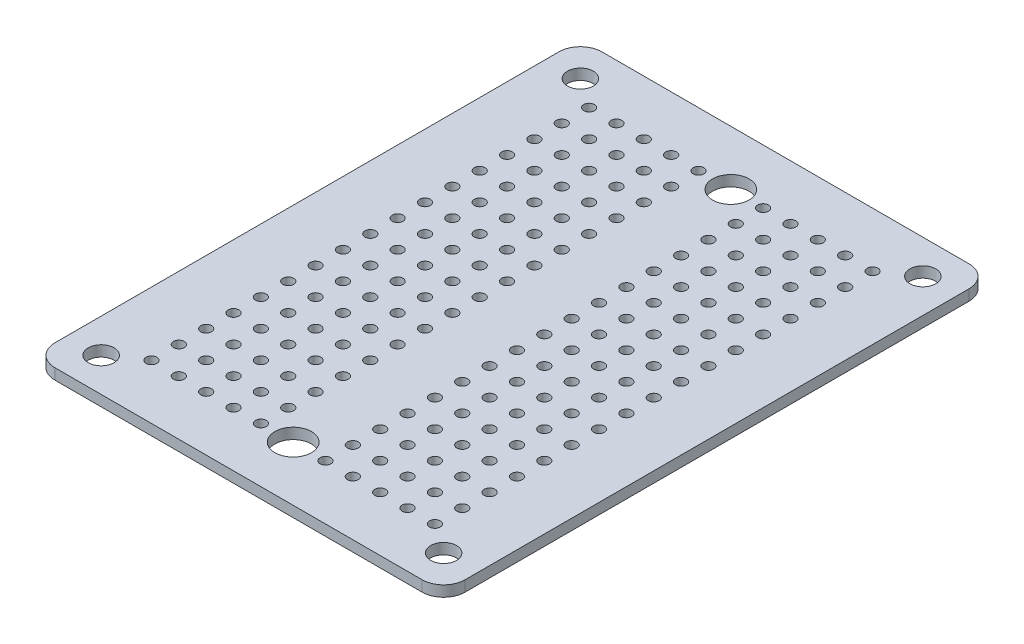
from build123d import *

# Parameters (mm, degrees)
SKETCH2_W                = 38.1
SKETCH2_H                = 50.8
BOSS_EXTRUDE1_DEPTH      = 0.5
M2_CLEARANCE_HOLE1_D     = 2.4
M3_CLEARANCE_HOLE1_D     = 3.4
FILLET2_R                = 2
SKETCH7_R                = 0.5
CUT_EXTRUDE1_DEPTH       = 32.765744128
LPATTERN1_COUNT          = 5
LPATTERN1_PITCH          = 2.54
LPATTERN1_COUNT_DIR2     = 17
LPATTERN1_PITCH_DIR2     = 2.54
MIRROR1_COPY_1_SKETCH_R  = 0.5
MIRROR1_COPY_1_DEPTH     = 32.765744128
MIRROR1_COPY_2_SKETCH_R  = 0.5
MIRROR1_COPY_2_DEPTH     = 32.765744128
MIRROR1_COPY_3_SKETCH_R  = 0.5
MIRROR1_COPY_3_DEPTH     = 32.765744128
MIRROR1_COPY_4_SKETCH_R  = 0.5
MIRROR1_COPY_4_DEPTH     = 32.765744128
MIRROR1_COPY_5_SKETCH_R  = 0.5
MIRROR1_COPY_5_DEPTH     = 32.765744128
MIRROR1_COPY_6_SKETCH_R  = 0.5
MIRROR1_COPY_6_DEPTH     = 32.765744128
MIRROR1_COPY_7_SKETCH_R  = 0.5
MIRROR1_COPY_7_DEPTH     = 32.765744128
MIRROR1_COPY_8_SKETCH_R  = 0.5
MIRROR1_COPY_8_DEPTH     = 32.765744128
MIRROR1_COPY_9_SKETCH_R  = 0.5
MIRROR1_COPY_9_DEPTH     = 32.765744128
MIRROR1_COPY_10_SKETCH_R = 0.5
MIRROR1_COPY_10_DEPTH    = 32.765744128
MIRROR1_COPY_11_SKETCH_R = 0.5
MIRROR1_COPY_11_DEPTH    = 32.765744128
MIRROR1_COPY_12_SKETCH_R = 0.5
MIRROR1_COPY_12_DEPTH    = 32.765744128
MIRROR1_COPY_13_SKETCH_R = 0.5
MIRROR1_COPY_13_DEPTH    = 32.765744128
MIRROR1_COPY_14_SKETCH_R = 0.5
MIRROR1_COPY_14_DEPTH    = 32.765744128
MIRROR1_COPY_15_SKETCH_R = 0.5
MIRROR1_COPY_15_DEPTH    = 32.765744128
MIRROR1_COPY_16_SKETCH_R = 0.5
MIRROR1_COPY_16_DEPTH    = 32.765744128
MIRROR1_COPY_17_SKETCH_R = 0.5
MIRROR1_COPY_17_DEPTH    = 32.765744128
MIRROR1_COPY_18_SKETCH_R = 0.5
MIRROR1_COPY_18_DEPTH    = 32.765744128
MIRROR1_COPY_19_SKETCH_R = 0.5
MIRROR1_COPY_19_DEPTH    = 32.765744128
MIRROR1_COPY_20_SKETCH_R = 0.5
MIRROR1_COPY_20_DEPTH    = 32.765744128
MIRROR1_COPY_21_SKETCH_R = 0.5
MIRROR1_COPY_21_DEPTH    = 32.765744128
MIRROR1_COPY_22_SKETCH_R = 0.5
MIRROR1_COPY_22_DEPTH    = 32.765744128
MIRROR1_COPY_23_SKETCH_R = 0.5
MIRROR1_COPY_23_DEPTH    = 32.765744128
MIRROR1_COPY_24_SKETCH_R = 0.5
MIRROR1_COPY_24_DEPTH    = 32.765744128
MIRROR1_COPY_25_SKETCH_R = 0.5
MIRROR1_COPY_25_DEPTH    = 32.765744128
MIRROR1_COPY_26_SKETCH_R = 0.5
MIRROR1_COPY_26_DEPTH    = 32.765744128
MIRROR1_COPY_27_SKETCH_R = 0.5
MIRROR1_COPY_27_DEPTH    = 32.765744128
MIRROR1_COPY_28_SKETCH_R = 0.5
MIRROR1_COPY_28_DEPTH    = 32.765744128
MIRROR1_COPY_29_SKETCH_R = 0.5
MIRROR1_COPY_29_DEPTH    = 32.765744128
MIRROR1_COPY_30_SKETCH_R = 0.5
MIRROR1_COPY_30_DEPTH    = 32.765744128
MIRROR1_COPY_31_SKETCH_R = 0.5
MIRROR1_COPY_31_DEPTH    = 32.765744128
MIRROR1_COPY_32_SKETCH_R = 0.5
MIRROR1_COPY_32_DEPTH    = 32.765744128
MIRROR1_COPY_33_SKETCH_R = 0.5
MIRROR1_COPY_33_DEPTH    = 32.765744128
MIRROR1_COPY_34_SKETCH_R = 0.5
MIRROR1_COPY_34_DEPTH    = 32.765744128
MIRROR1_COPY_35_SKETCH_R = 0.5
MIRROR1_COPY_35_DEPTH    = 32.765744128
MIRROR1_COPY_36_SKETCH_R = 0.5
MIRROR1_COPY_36_DEPTH    = 32.765744128
MIRROR1_COPY_37_SKETCH_R = 0.5
MIRROR1_COPY_37_DEPTH    = 32.765744128
MIRROR1_COPY_38_SKETCH_R = 0.5
MIRROR1_COPY_38_DEPTH    = 32.765744128
MIRROR1_COPY_39_SKETCH_R = 0.5
MIRROR1_COPY_39_DEPTH    = 32.765744128
MIRROR1_COPY_40_SKETCH_R = 0.5
MIRROR1_COPY_40_DEPTH    = 32.765744128
MIRROR1_COPY_41_SKETCH_R = 0.5
MIRROR1_COPY_41_DEPTH    = 32.765744128
MIRROR1_COPY_42_SKETCH_R = 0.5
MIRROR1_COPY_42_DEPTH    = 32.765744128
MIRROR1_COPY_43_SKETCH_R = 0.5
MIRROR1_COPY_43_DEPTH    = 32.765744128
MIRROR1_COPY_44_SKETCH_R = 0.5
MIRROR1_COPY_44_DEPTH    = 32.765744128
MIRROR1_COPY_45_SKETCH_R = 0.5
MIRROR1_COPY_45_DEPTH    = 32.765744128
MIRROR1_COPY_46_SKETCH_R = 0.5
MIRROR1_COPY_46_DEPTH    = 32.765744128
MIRROR1_COPY_47_SKETCH_R = 0.5
MIRROR1_COPY_47_DEPTH    = 32.765744128
MIRROR1_COPY_48_SKETCH_R = 0.5
MIRROR1_COPY_48_DEPTH    = 32.765744128
MIRROR1_COPY_49_SKETCH_R = 0.5
MIRROR1_COPY_49_DEPTH    = 32.765744128
MIRROR1_COPY_50_SKETCH_R = 0.5
MIRROR1_COPY_50_DEPTH    = 32.765744128
MIRROR1_COPY_51_SKETCH_R = 0.5
MIRROR1_COPY_51_DEPTH    = 32.765744128
MIRROR1_COPY_52_SKETCH_R = 0.5
MIRROR1_COPY_52_DEPTH    = 32.765744128
MIRROR1_COPY_53_SKETCH_R = 0.5
MIRROR1_COPY_53_DEPTH    = 32.765744128
MIRROR1_COPY_54_SKETCH_R = 0.5
MIRROR1_COPY_54_DEPTH    = 32.765744128
MIRROR1_COPY_55_SKETCH_R = 0.5
MIRROR1_COPY_55_DEPTH    = 32.765744128
MIRROR1_COPY_56_SKETCH_R = 0.5
MIRROR1_COPY_56_DEPTH    = 32.765744128
MIRROR1_COPY_57_SKETCH_R = 0.5
MIRROR1_COPY_57_DEPTH    = 32.765744128
MIRROR1_COPY_58_SKETCH_R = 0.5
MIRROR1_COPY_58_DEPTH    = 32.765744128
MIRROR1_COPY_59_SKETCH_R = 0.5
MIRROR1_COPY_59_DEPTH    = 32.765744128
MIRROR1_COPY_60_SKETCH_R = 0.5
MIRROR1_COPY_60_DEPTH    = 32.765744128
MIRROR1_COPY_61_SKETCH_R = 0.5
MIRROR1_COPY_61_DEPTH    = 32.765744128
MIRROR1_COPY_62_SKETCH_R = 0.5
MIRROR1_COPY_62_DEPTH    = 32.765744128
MIRROR1_COPY_63_SKETCH_R = 0.5
MIRROR1_COPY_63_DEPTH    = 32.765744128
MIRROR1_COPY_64_SKETCH_R = 0.5
MIRROR1_COPY_64_DEPTH    = 32.765744128
MIRROR1_COPY_65_SKETCH_R = 0.5
MIRROR1_COPY_65_DEPTH    = 32.765744128
MIRROR1_COPY_66_SKETCH_R = 0.5
MIRROR1_COPY_66_DEPTH    = 32.765744128
MIRROR1_COPY_67_SKETCH_R = 0.5
MIRROR1_COPY_67_DEPTH    = 32.765744128
MIRROR1_COPY_68_SKETCH_R = 0.5
MIRROR1_COPY_68_DEPTH    = 32.765744128
MIRROR1_COPY_69_SKETCH_R = 0.5
MIRROR1_COPY_69_DEPTH    = 32.765744128
MIRROR1_COPY_70_SKETCH_R = 0.5
MIRROR1_COPY_70_DEPTH    = 32.765744128
MIRROR1_COPY_71_SKETCH_R = 0.5
MIRROR1_COPY_71_DEPTH    = 32.765744128
MIRROR1_COPY_72_SKETCH_R = 0.5
MIRROR1_COPY_72_DEPTH    = 32.765744128
MIRROR1_COPY_73_SKETCH_R = 0.5
MIRROR1_COPY_73_DEPTH    = 32.765744128
MIRROR1_COPY_74_SKETCH_R = 0.5
MIRROR1_COPY_74_DEPTH    = 32.765744128
MIRROR1_COPY_75_SKETCH_R = 0.5
MIRROR1_COPY_75_DEPTH    = 32.765744128
MIRROR1_COPY_76_SKETCH_R = 0.5
MIRROR1_COPY_76_DEPTH    = 32.765744128
MIRROR1_COPY_77_SKETCH_R = 0.5
MIRROR1_COPY_77_DEPTH    = 32.765744128
MIRROR1_COPY_78_SKETCH_R = 0.5
MIRROR1_COPY_78_DEPTH    = 32.765744128
MIRROR1_COPY_79_SKETCH_R = 0.5
MIRROR1_COPY_79_DEPTH    = 32.765744128
MIRROR1_COPY_80_SKETCH_R = 0.5
MIRROR1_COPY_80_DEPTH    = 32.765744128
MIRROR1_COPY_81_SKETCH_R = 0.5
MIRROR1_COPY_81_DEPTH    = 32.765744128
MIRROR1_COPY_82_SKETCH_R = 0.5
MIRROR1_COPY_82_DEPTH    = 32.765744128
MIRROR1_COPY_83_SKETCH_R = 0.5
MIRROR1_COPY_83_DEPTH    = 32.765744128
MIRROR1_COPY_84_SKETCH_R = 0.5
MIRROR1_COPY_84_DEPTH    = 32.765744128


with BuildPart() as part:
    # Sketch2 → Boss-Extrude1 (new, symmetric)
    with BuildSketch(Plane(origin=(0, 0, 0), x_dir=(1, 0, 0), z_dir=(0, 1, 0))):
        Rectangle(SKETCH2_W, SKETCH2_H)
    extrude(amount=BOSS_EXTRUDE1_DEPTH, both=True)

    # M2 Clearance Hole1 (through all)
    with Locations(Plane(origin=(0, 0.5, 0), x_dir=(1, 0, 0), z_dir=(0, 1, 0))):
        with Locations((15.9, 22.25), (-15.9, -22.25), (-15.9, 22.25), (15.9, -22.25)):
            Hole(M2_CLEARANCE_HOLE1_D / 2)

    # M3 Clearance Hole1 (through all)
    with Locations(Plane(origin=(0, 0.5, 0), x_dir=(1, 0, 0), z_dir=(0, 1, 0))):
        with Locations((0, 20.32), (0, -20.32)):
            Hole(M3_CLEARANCE_HOLE1_D / 2)

    # Fillet2
    fillet2_edges = [part.edges().sort_by_distance(p)[0] for p in [
        (19.05, 0, 25.4),
        (-19.05, 0, 25.4),
        (-19.05, 0, -25.4),
        (19.05, 0, -25.4),
    ]]
    fillet(fillet2_edges, radius=FILLET2_R)

    # Sketch7 → Cut-Extrude1 (cut, symmetric)
    with BuildSketch(Plane(origin=(0, 0.5, 0), x_dir=(1, 0, 0), z_dir=(0, 1, 0))):
        with Locations(Location((-3, 20.32, 0), (0, 0, 270))):
            Circle(SKETCH7_R)
    cut_extrude1 = extrude(amount=CUT_EXTRUDE1_DEPTH, both=True, mode=Mode.SUBTRACT)

    # LPattern1: Cut-Extrude1 5 × 17
    with Locations(*[(-i * LPATTERN1_PITCH, 0, j * LPATTERN1_PITCH_DIR2) for i in range(LPATTERN1_COUNT) for j in range(LPATTERN1_COUNT_DIR2) if (i, j) != (0, 0)]):
        add(cut_extrude1, mode=Mode.SUBTRACT)

    # Mirror1: Cut-Extrude1 across plane
    add(cut_extrude1.mirror(Plane(origin=(0, 0, 0), x_dir=(0, 0, 1), z_dir=(1, 0, 0))), mode=Mode.SUBTRACT)

    # Mirror1 copy 1 sketch → Mirror1 copy 1 (cut, symmetric)
    with BuildSketch(Plane(origin=(0, 0.5, 2.54), x_dir=(-1, 0, 0), z_dir=(0, 1, 0))):
        with Locations((-3, -20.32)):
            Circle(MIRROR1_COPY_1_SKETCH_R)
    extrude(amount=MIRROR1_COPY_1_DEPTH, both=True, mode=Mode.SUBTRACT)

    # Mirror1 copy 2 sketch → Mirror1 copy 2 (cut, symmetric)
    with BuildSketch(Plane(origin=(0, 0.5, 5.08), x_dir=(-1, 0, 0), z_dir=(0, 1, 0))):
        with Locations((-3, -20.32)):
            Circle(MIRROR1_COPY_2_SKETCH_R)
    extrude(amount=MIRROR1_COPY_2_DEPTH, both=True, mode=Mode.SUBTRACT)

    # Mirror1 copy 3 sketch → Mirror1 copy 3 (cut, symmetric)
    with BuildSketch(Plane(origin=(0, 0.5, 7.62), x_dir=(-1, 0, 0), z_dir=(0, 1, 0))):
        with Locations((-3, -20.32)):
            Circle(MIRROR1_COPY_3_SKETCH_R)
    extrude(amount=MIRROR1_COPY_3_DEPTH, both=True, mode=Mode.SUBTRACT)

    # Mirror1 copy 4 sketch → Mirror1 copy 4 (cut, symmetric)
    with BuildSketch(Plane(origin=(0, 0.5, 10.16), x_dir=(-1, 0, 0), z_dir=(0, 1, 0))):
        with Locations((-3, -20.32)):
            Circle(MIRROR1_COPY_4_SKETCH_R)
    extrude(amount=MIRROR1_COPY_4_DEPTH, both=True, mode=Mode.SUBTRACT)

    # Mirror1 copy 5 sketch → Mirror1 copy 5 (cut, symmetric)
    with BuildSketch(Plane(origin=(0, 0.5, 12.7), x_dir=(-1, 0, 0), z_dir=(0, 1, 0))):
        with Locations((-3, -20.32)):
            Circle(MIRROR1_COPY_5_SKETCH_R)
    extrude(amount=MIRROR1_COPY_5_DEPTH, both=True, mode=Mode.SUBTRACT)

    # Mirror1 copy 6 sketch → Mirror1 copy 6 (cut, symmetric)
    with BuildSketch(Plane(origin=(0, 0.5, 15.24), x_dir=(-1, 0, 0), z_dir=(0, 1, 0))):
        with Locations((-3, -20.32)):
            Circle(MIRROR1_COPY_6_SKETCH_R)
    extrude(amount=MIRROR1_COPY_6_DEPTH, both=True, mode=Mode.SUBTRACT)

    # Mirror1 copy 7 sketch → Mirror1 copy 7 (cut, symmetric)
    with BuildSketch(Plane(origin=(0, 0.5, 17.78), x_dir=(-1, 0, 0), z_dir=(0, 1, 0))):
        with Locations((-3, -20.32)):
            Circle(MIRROR1_COPY_7_SKETCH_R)
    extrude(amount=MIRROR1_COPY_7_DEPTH, both=True, mode=Mode.SUBTRACT)

    # Mirror1 copy 8 sketch → Mirror1 copy 8 (cut, symmetric)
    with BuildSketch(Plane(origin=(0, 0.5, 20.32), x_dir=(-1, 0, 0), z_dir=(0, 1, 0))):
        with Locations((-3, -20.32)):
            Circle(MIRROR1_COPY_8_SKETCH_R)
    extrude(amount=MIRROR1_COPY_8_DEPTH, both=True, mode=Mode.SUBTRACT)

    # Mirror1 copy 9 sketch → Mirror1 copy 9 (cut, symmetric)
    with BuildSketch(Plane(origin=(0, 0.5, 22.86), x_dir=(-1, 0, 0), z_dir=(0, 1, 0))):
        with Locations((-3, -20.32)):
            Circle(MIRROR1_COPY_9_SKETCH_R)
    extrude(amount=MIRROR1_COPY_9_DEPTH, both=True, mode=Mode.SUBTRACT)

    # Mirror1 copy 10 sketch → Mirror1 copy 10 (cut, symmetric)
    with BuildSketch(Plane(origin=(0, 0.5, 25.4), x_dir=(-1, 0, 0), z_dir=(0, 1, 0))):
        with Locations((-3, -20.32)):
            Circle(MIRROR1_COPY_10_SKETCH_R)
    extrude(amount=MIRROR1_COPY_10_DEPTH, both=True, mode=Mode.SUBTRACT)

    # Mirror1 copy 11 sketch → Mirror1 copy 11 (cut, symmetric)
    with BuildSketch(Plane(origin=(0, 0.5, 27.94), x_dir=(-1, 0, 0), z_dir=(0, 1, 0))):
        with Locations((-3, -20.32)):
            Circle(MIRROR1_COPY_11_SKETCH_R)
    extrude(amount=MIRROR1_COPY_11_DEPTH, both=True, mode=Mode.SUBTRACT)

    # Mirror1 copy 12 sketch → Mirror1 copy 12 (cut, symmetric)
    with BuildSketch(Plane(origin=(0, 0.5, 30.48), x_dir=(-1, 0, 0), z_dir=(0, 1, 0))):
        with Locations((-3, -20.32)):
            Circle(MIRROR1_COPY_12_SKETCH_R)
    extrude(amount=MIRROR1_COPY_12_DEPTH, both=True, mode=Mode.SUBTRACT)

    # Mirror1 copy 13 sketch → Mirror1 copy 13 (cut, symmetric)
    with BuildSketch(Plane(origin=(0, 0.5, 33.02), x_dir=(-1, 0, 0), z_dir=(0, 1, 0))):
        with Locations((-3, -20.32)):
            Circle(MIRROR1_COPY_13_SKETCH_R)
    extrude(amount=MIRROR1_COPY_13_DEPTH, both=True, mode=Mode.SUBTRACT)

    # Mirror1 copy 14 sketch → Mirror1 copy 14 (cut, symmetric)
    with BuildSketch(Plane(origin=(0, 0.5, 35.56), x_dir=(-1, 0, 0), z_dir=(0, 1, 0))):
        with Locations((-3, -20.32)):
            Circle(MIRROR1_COPY_14_SKETCH_R)
    extrude(amount=MIRROR1_COPY_14_DEPTH, both=True, mode=Mode.SUBTRACT)

    # Mirror1 copy 15 sketch → Mirror1 copy 15 (cut, symmetric)
    with BuildSketch(Plane(origin=(0, 0.5, 38.1), x_dir=(-1, 0, 0), z_dir=(0, 1, 0))):
        with Locations((-3, -20.32)):
            Circle(MIRROR1_COPY_15_SKETCH_R)
    extrude(amount=MIRROR1_COPY_15_DEPTH, both=True, mode=Mode.SUBTRACT)

    # Mirror1 copy 16 sketch → Mirror1 copy 16 (cut, symmetric)
    with BuildSketch(Plane(origin=(0, 0.5, 40.64), x_dir=(-1, 0, 0), z_dir=(0, 1, 0))):
        with Locations((-3, -20.32)):
            Circle(MIRROR1_COPY_16_SKETCH_R)
    extrude(amount=MIRROR1_COPY_16_DEPTH, both=True, mode=Mode.SUBTRACT)

    # Mirror1 copy 17 sketch → Mirror1 copy 17 (cut, symmetric)
    with BuildSketch(Plane(origin=(2.54, 0.5, 0), x_dir=(-1, 0, 0), z_dir=(0, 1, 0))):
        with Locations((-3, -20.32)):
            Circle(MIRROR1_COPY_17_SKETCH_R)
    extrude(amount=MIRROR1_COPY_17_DEPTH, both=True, mode=Mode.SUBTRACT)

    # Mirror1 copy 18 sketch → Mirror1 copy 18 (cut, symmetric)
    with BuildSketch(Plane(origin=(2.54, 0.5, 2.54), x_dir=(-1, 0, 0), z_dir=(0, 1, 0))):
        with Locations((-3, -20.32)):
            Circle(MIRROR1_COPY_18_SKETCH_R)
    extrude(amount=MIRROR1_COPY_18_DEPTH, both=True, mode=Mode.SUBTRACT)

    # Mirror1 copy 19 sketch → Mirror1 copy 19 (cut, symmetric)
    with BuildSketch(Plane(origin=(2.54, 0.5, 5.08), x_dir=(-1, 0, 0), z_dir=(0, 1, 0))):
        with Locations((-3, -20.32)):
            Circle(MIRROR1_COPY_19_SKETCH_R)
    extrude(amount=MIRROR1_COPY_19_DEPTH, both=True, mode=Mode.SUBTRACT)

    # Mirror1 copy 20 sketch → Mirror1 copy 20 (cut, symmetric)
    with BuildSketch(Plane(origin=(2.54, 0.5, 7.62), x_dir=(-1, 0, 0), z_dir=(0, 1, 0))):
        with Locations((-3, -20.32)):
            Circle(MIRROR1_COPY_20_SKETCH_R)
    extrude(amount=MIRROR1_COPY_20_DEPTH, both=True, mode=Mode.SUBTRACT)

    # Mirror1 copy 21 sketch → Mirror1 copy 21 (cut, symmetric)
    with BuildSketch(Plane(origin=(2.54, 0.5, 10.16), x_dir=(-1, 0, 0), z_dir=(0, 1, 0))):
        with Locations((-3, -20.32)):
            Circle(MIRROR1_COPY_21_SKETCH_R)
    extrude(amount=MIRROR1_COPY_21_DEPTH, both=True, mode=Mode.SUBTRACT)

    # Mirror1 copy 22 sketch → Mirror1 copy 22 (cut, symmetric)
    with BuildSketch(Plane(origin=(2.54, 0.5, 12.7), x_dir=(-1, 0, 0), z_dir=(0, 1, 0))):
        with Locations((-3, -20.32)):
            Circle(MIRROR1_COPY_22_SKETCH_R)
    extrude(amount=MIRROR1_COPY_22_DEPTH, both=True, mode=Mode.SUBTRACT)

    # Mirror1 copy 23 sketch → Mirror1 copy 23 (cut, symmetric)
    with BuildSketch(Plane(origin=(2.54, 0.5, 15.24), x_dir=(-1, 0, 0), z_dir=(0, 1, 0))):
        with Locations((-3, -20.32)):
            Circle(MIRROR1_COPY_23_SKETCH_R)
    extrude(amount=MIRROR1_COPY_23_DEPTH, both=True, mode=Mode.SUBTRACT)

    # Mirror1 copy 24 sketch → Mirror1 copy 24 (cut, symmetric)
    with BuildSketch(Plane(origin=(2.54, 0.5, 17.78), x_dir=(-1, 0, 0), z_dir=(0, 1, 0))):
        with Locations((-3, -20.32)):
            Circle(MIRROR1_COPY_24_SKETCH_R)
    extrude(amount=MIRROR1_COPY_24_DEPTH, both=True, mode=Mode.SUBTRACT)

    # Mirror1 copy 25 sketch → Mirror1 copy 25 (cut, symmetric)
    with BuildSketch(Plane(origin=(2.54, 0.5, 20.32), x_dir=(-1, 0, 0), z_dir=(0, 1, 0))):
        with Locations((-3, -20.32)):
            Circle(MIRROR1_COPY_25_SKETCH_R)
    extrude(amount=MIRROR1_COPY_25_DEPTH, both=True, mode=Mode.SUBTRACT)

    # Mirror1 copy 26 sketch → Mirror1 copy 26 (cut, symmetric)
    with BuildSketch(Plane(origin=(2.54, 0.5, 22.86), x_dir=(-1, 0, 0), z_dir=(0, 1, 0))):
        with Locations((-3, -20.32)):
            Circle(MIRROR1_COPY_26_SKETCH_R)
    extrude(amount=MIRROR1_COPY_26_DEPTH, both=True, mode=Mode.SUBTRACT)

    # Mirror1 copy 27 sketch → Mirror1 copy 27 (cut, symmetric)
    with BuildSketch(Plane(origin=(2.54, 0.5, 25.4), x_dir=(-1, 0, 0), z_dir=(0, 1, 0))):
        with Locations((-3, -20.32)):
            Circle(MIRROR1_COPY_27_SKETCH_R)
    extrude(amount=MIRROR1_COPY_27_DEPTH, both=True, mode=Mode.SUBTRACT)

    # Mirror1 copy 28 sketch → Mirror1 copy 28 (cut, symmetric)
    with BuildSketch(Plane(origin=(2.54, 0.5, 27.94), x_dir=(-1, 0, 0), z_dir=(0, 1, 0))):
        with Locations((-3, -20.32)):
            Circle(MIRROR1_COPY_28_SKETCH_R)
    extrude(amount=MIRROR1_COPY_28_DEPTH, both=True, mode=Mode.SUBTRACT)

    # Mirror1 copy 29 sketch → Mirror1 copy 29 (cut, symmetric)
    with BuildSketch(Plane(origin=(2.54, 0.5, 30.48), x_dir=(-1, 0, 0), z_dir=(0, 1, 0))):
        with Locations((-3, -20.32)):
            Circle(MIRROR1_COPY_29_SKETCH_R)
    extrude(amount=MIRROR1_COPY_29_DEPTH, both=True, mode=Mode.SUBTRACT)

    # Mirror1 copy 30 sketch → Mirror1 copy 30 (cut, symmetric)
    with BuildSketch(Plane(origin=(2.54, 0.5, 33.02), x_dir=(-1, 0, 0), z_dir=(0, 1, 0))):
        with Locations((-3, -20.32)):
            Circle(MIRROR1_COPY_30_SKETCH_R)
    extrude(amount=MIRROR1_COPY_30_DEPTH, both=True, mode=Mode.SUBTRACT)

    # Mirror1 copy 31 sketch → Mirror1 copy 31 (cut, symmetric)
    with BuildSketch(Plane(origin=(2.54, 0.5, 35.56), x_dir=(-1, 0, 0), z_dir=(0, 1, 0))):
        with Locations((-3, -20.32)):
            Circle(MIRROR1_COPY_31_SKETCH_R)
    extrude(amount=MIRROR1_COPY_31_DEPTH, both=True, mode=Mode.SUBTRACT)

    # Mirror1 copy 32 sketch → Mirror1 copy 32 (cut, symmetric)
    with BuildSketch(Plane(origin=(2.54, 0.5, 38.1), x_dir=(-1, 0, 0), z_dir=(0, 1, 0))):
        with Locations((-3, -20.32)):
            Circle(MIRROR1_COPY_32_SKETCH_R)
    extrude(amount=MIRROR1_COPY_32_DEPTH, both=True, mode=Mode.SUBTRACT)

    # Mirror1 copy 33 sketch → Mirror1 copy 33 (cut, symmetric)
    with BuildSketch(Plane(origin=(2.54, 0.5, 40.64), x_dir=(-1, 0, 0), z_dir=(0, 1, 0))):
        with Locations((-3, -20.32)):
            Circle(MIRROR1_COPY_33_SKETCH_R)
    extrude(amount=MIRROR1_COPY_33_DEPTH, both=True, mode=Mode.SUBTRACT)

    # Mirror1 copy 34 sketch → Mirror1 copy 34 (cut, symmetric)
    with BuildSketch(Plane(origin=(5.08, 0.5, 0), x_dir=(-1, 0, 0), z_dir=(0, 1, 0))):
        with Locations((-3, -20.32)):
            Circle(MIRROR1_COPY_34_SKETCH_R)
    extrude(amount=MIRROR1_COPY_34_DEPTH, both=True, mode=Mode.SUBTRACT)

    # Mirror1 copy 35 sketch → Mirror1 copy 35 (cut, symmetric)
    with BuildSketch(Plane(origin=(5.08, 0.5, 2.54), x_dir=(-1, 0, 0), z_dir=(0, 1, 0))):
        with Locations((-3, -20.32)):
            Circle(MIRROR1_COPY_35_SKETCH_R)
    extrude(amount=MIRROR1_COPY_35_DEPTH, both=True, mode=Mode.SUBTRACT)

    # Mirror1 copy 36 sketch → Mirror1 copy 36 (cut, symmetric)
    with BuildSketch(Plane(origin=(5.08, 0.5, 5.08), x_dir=(-1, 0, 0), z_dir=(0, 1, 0))):
        with Locations((-3, -20.32)):
            Circle(MIRROR1_COPY_36_SKETCH_R)
    extrude(amount=MIRROR1_COPY_36_DEPTH, both=True, mode=Mode.SUBTRACT)

    # Mirror1 copy 37 sketch → Mirror1 copy 37 (cut, symmetric)
    with BuildSketch(Plane(origin=(5.08, 0.5, 7.62), x_dir=(-1, 0, 0), z_dir=(0, 1, 0))):
        with Locations((-3, -20.32)):
            Circle(MIRROR1_COPY_37_SKETCH_R)
    extrude(amount=MIRROR1_COPY_37_DEPTH, both=True, mode=Mode.SUBTRACT)

    # Mirror1 copy 38 sketch → Mirror1 copy 38 (cut, symmetric)
    with BuildSketch(Plane(origin=(5.08, 0.5, 10.16), x_dir=(-1, 0, 0), z_dir=(0, 1, 0))):
        with Locations((-3, -20.32)):
            Circle(MIRROR1_COPY_38_SKETCH_R)
    extrude(amount=MIRROR1_COPY_38_DEPTH, both=True, mode=Mode.SUBTRACT)

    # Mirror1 copy 39 sketch → Mirror1 copy 39 (cut, symmetric)
    with BuildSketch(Plane(origin=(5.08, 0.5, 12.7), x_dir=(-1, 0, 0), z_dir=(0, 1, 0))):
        with Locations((-3, -20.32)):
            Circle(MIRROR1_COPY_39_SKETCH_R)
    extrude(amount=MIRROR1_COPY_39_DEPTH, both=True, mode=Mode.SUBTRACT)

    # Mirror1 copy 40 sketch → Mirror1 copy 40 (cut, symmetric)
    with BuildSketch(Plane(origin=(5.08, 0.5, 15.24), x_dir=(-1, 0, 0), z_dir=(0, 1, 0))):
        with Locations((-3, -20.32)):
            Circle(MIRROR1_COPY_40_SKETCH_R)
    extrude(amount=MIRROR1_COPY_40_DEPTH, both=True, mode=Mode.SUBTRACT)

    # Mirror1 copy 41 sketch → Mirror1 copy 41 (cut, symmetric)
    with BuildSketch(Plane(origin=(5.08, 0.5, 17.78), x_dir=(-1, 0, 0), z_dir=(0, 1, 0))):
        with Locations((-3, -20.32)):
            Circle(MIRROR1_COPY_41_SKETCH_R)
    extrude(amount=MIRROR1_COPY_41_DEPTH, both=True, mode=Mode.SUBTRACT)

    # Mirror1 copy 42 sketch → Mirror1 copy 42 (cut, symmetric)
    with BuildSketch(Plane(origin=(5.08, 0.5, 20.32), x_dir=(-1, 0, 0), z_dir=(0, 1, 0))):
        with Locations((-3, -20.32)):
            Circle(MIRROR1_COPY_42_SKETCH_R)
    extrude(amount=MIRROR1_COPY_42_DEPTH, both=True, mode=Mode.SUBTRACT)

    # Mirror1 copy 43 sketch → Mirror1 copy 43 (cut, symmetric)
    with BuildSketch(Plane(origin=(5.08, 0.5, 22.86), x_dir=(-1, 0, 0), z_dir=(0, 1, 0))):
        with Locations((-3, -20.32)):
            Circle(MIRROR1_COPY_43_SKETCH_R)
    extrude(amount=MIRROR1_COPY_43_DEPTH, both=True, mode=Mode.SUBTRACT)

    # Mirror1 copy 44 sketch → Mirror1 copy 44 (cut, symmetric)
    with BuildSketch(Plane(origin=(5.08, 0.5, 25.4), x_dir=(-1, 0, 0), z_dir=(0, 1, 0))):
        with Locations((-3, -20.32)):
            Circle(MIRROR1_COPY_44_SKETCH_R)
    extrude(amount=MIRROR1_COPY_44_DEPTH, both=True, mode=Mode.SUBTRACT)

    # Mirror1 copy 45 sketch → Mirror1 copy 45 (cut, symmetric)
    with BuildSketch(Plane(origin=(5.08, 0.5, 27.94), x_dir=(-1, 0, 0), z_dir=(0, 1, 0))):
        with Locations((-3, -20.32)):
            Circle(MIRROR1_COPY_45_SKETCH_R)
    extrude(amount=MIRROR1_COPY_45_DEPTH, both=True, mode=Mode.SUBTRACT)

    # Mirror1 copy 46 sketch → Mirror1 copy 46 (cut, symmetric)
    with BuildSketch(Plane(origin=(5.08, 0.5, 30.48), x_dir=(-1, 0, 0), z_dir=(0, 1, 0))):
        with Locations((-3, -20.32)):
            Circle(MIRROR1_COPY_46_SKETCH_R)
    extrude(amount=MIRROR1_COPY_46_DEPTH, both=True, mode=Mode.SUBTRACT)

    # Mirror1 copy 47 sketch → Mirror1 copy 47 (cut, symmetric)
    with BuildSketch(Plane(origin=(5.08, 0.5, 33.02), x_dir=(-1, 0, 0), z_dir=(0, 1, 0))):
        with Locations((-3, -20.32)):
            Circle(MIRROR1_COPY_47_SKETCH_R)
    extrude(amount=MIRROR1_COPY_47_DEPTH, both=True, mode=Mode.SUBTRACT)

    # Mirror1 copy 48 sketch → Mirror1 copy 48 (cut, symmetric)
    with BuildSketch(Plane(origin=(5.08, 0.5, 35.56), x_dir=(-1, 0, 0), z_dir=(0, 1, 0))):
        with Locations((-3, -20.32)):
            Circle(MIRROR1_COPY_48_SKETCH_R)
    extrude(amount=MIRROR1_COPY_48_DEPTH, both=True, mode=Mode.SUBTRACT)

    # Mirror1 copy 49 sketch → Mirror1 copy 49 (cut, symmetric)
    with BuildSketch(Plane(origin=(5.08, 0.5, 38.1), x_dir=(-1, 0, 0), z_dir=(0, 1, 0))):
        with Locations((-3, -20.32)):
            Circle(MIRROR1_COPY_49_SKETCH_R)
    extrude(amount=MIRROR1_COPY_49_DEPTH, both=True, mode=Mode.SUBTRACT)

    # Mirror1 copy 50 sketch → Mirror1 copy 50 (cut, symmetric)
    with BuildSketch(Plane(origin=(5.08, 0.5, 40.64), x_dir=(-1, 0, 0), z_dir=(0, 1, 0))):
        with Locations((-3, -20.32)):
            Circle(MIRROR1_COPY_50_SKETCH_R)
    extrude(amount=MIRROR1_COPY_50_DEPTH, both=True, mode=Mode.SUBTRACT)

    # Mirror1 copy 51 sketch → Mirror1 copy 51 (cut, symmetric)
    with BuildSketch(Plane(origin=(7.62, 0.5, 0), x_dir=(-1, 0, 0), z_dir=(0, 1, 0))):
        with Locations((-3, -20.32)):
            Circle(MIRROR1_COPY_51_SKETCH_R)
    extrude(amount=MIRROR1_COPY_51_DEPTH, both=True, mode=Mode.SUBTRACT)

    # Mirror1 copy 52 sketch → Mirror1 copy 52 (cut, symmetric)
    with BuildSketch(Plane(origin=(7.62, 0.5, 2.54), x_dir=(-1, 0, 0), z_dir=(0, 1, 0))):
        with Locations((-3, -20.32)):
            Circle(MIRROR1_COPY_52_SKETCH_R)
    extrude(amount=MIRROR1_COPY_52_DEPTH, both=True, mode=Mode.SUBTRACT)

    # Mirror1 copy 53 sketch → Mirror1 copy 53 (cut, symmetric)
    with BuildSketch(Plane(origin=(7.62, 0.5, 5.08), x_dir=(-1, 0, 0), z_dir=(0, 1, 0))):
        with Locations((-3, -20.32)):
            Circle(MIRROR1_COPY_53_SKETCH_R)
    extrude(amount=MIRROR1_COPY_53_DEPTH, both=True, mode=Mode.SUBTRACT)

    # Mirror1 copy 54 sketch → Mirror1 copy 54 (cut, symmetric)
    with BuildSketch(Plane(origin=(7.62, 0.5, 7.62), x_dir=(-1, 0, 0), z_dir=(0, 1, 0))):
        with Locations((-3, -20.32)):
            Circle(MIRROR1_COPY_54_SKETCH_R)
    extrude(amount=MIRROR1_COPY_54_DEPTH, both=True, mode=Mode.SUBTRACT)

    # Mirror1 copy 55 sketch → Mirror1 copy 55 (cut, symmetric)
    with BuildSketch(Plane(origin=(7.62, 0.5, 10.16), x_dir=(-1, 0, 0), z_dir=(0, 1, 0))):
        with Locations((-3, -20.32)):
            Circle(MIRROR1_COPY_55_SKETCH_R)
    extrude(amount=MIRROR1_COPY_55_DEPTH, both=True, mode=Mode.SUBTRACT)

    # Mirror1 copy 56 sketch → Mirror1 copy 56 (cut, symmetric)
    with BuildSketch(Plane(origin=(7.62, 0.5, 12.7), x_dir=(-1, 0, 0), z_dir=(0, 1, 0))):
        with Locations((-3, -20.32)):
            Circle(MIRROR1_COPY_56_SKETCH_R)
    extrude(amount=MIRROR1_COPY_56_DEPTH, both=True, mode=Mode.SUBTRACT)

    # Mirror1 copy 57 sketch → Mirror1 copy 57 (cut, symmetric)
    with BuildSketch(Plane(origin=(7.62, 0.5, 15.24), x_dir=(-1, 0, 0), z_dir=(0, 1, 0))):
        with Locations((-3, -20.32)):
            Circle(MIRROR1_COPY_57_SKETCH_R)
    extrude(amount=MIRROR1_COPY_57_DEPTH, both=True, mode=Mode.SUBTRACT)

    # Mirror1 copy 58 sketch → Mirror1 copy 58 (cut, symmetric)
    with BuildSketch(Plane(origin=(7.62, 0.5, 17.78), x_dir=(-1, 0, 0), z_dir=(0, 1, 0))):
        with Locations((-3, -20.32)):
            Circle(MIRROR1_COPY_58_SKETCH_R)
    extrude(amount=MIRROR1_COPY_58_DEPTH, both=True, mode=Mode.SUBTRACT)

    # Mirror1 copy 59 sketch → Mirror1 copy 59 (cut, symmetric)
    with BuildSketch(Plane(origin=(7.62, 0.5, 20.32), x_dir=(-1, 0, 0), z_dir=(0, 1, 0))):
        with Locations((-3, -20.32)):
            Circle(MIRROR1_COPY_59_SKETCH_R)
    extrude(amount=MIRROR1_COPY_59_DEPTH, both=True, mode=Mode.SUBTRACT)

    # Mirror1 copy 60 sketch → Mirror1 copy 60 (cut, symmetric)
    with BuildSketch(Plane(origin=(7.62, 0.5, 22.86), x_dir=(-1, 0, 0), z_dir=(0, 1, 0))):
        with Locations((-3, -20.32)):
            Circle(MIRROR1_COPY_60_SKETCH_R)
    extrude(amount=MIRROR1_COPY_60_DEPTH, both=True, mode=Mode.SUBTRACT)

    # Mirror1 copy 61 sketch → Mirror1 copy 61 (cut, symmetric)
    with BuildSketch(Plane(origin=(7.62, 0.5, 25.4), x_dir=(-1, 0, 0), z_dir=(0, 1, 0))):
        with Locations((-3, -20.32)):
            Circle(MIRROR1_COPY_61_SKETCH_R)
    extrude(amount=MIRROR1_COPY_61_DEPTH, both=True, mode=Mode.SUBTRACT)

    # Mirror1 copy 62 sketch → Mirror1 copy 62 (cut, symmetric)
    with BuildSketch(Plane(origin=(7.62, 0.5, 27.94), x_dir=(-1, 0, 0), z_dir=(0, 1, 0))):
        with Locations((-3, -20.32)):
            Circle(MIRROR1_COPY_62_SKETCH_R)
    extrude(amount=MIRROR1_COPY_62_DEPTH, both=True, mode=Mode.SUBTRACT)

    # Mirror1 copy 63 sketch → Mirror1 copy 63 (cut, symmetric)
    with BuildSketch(Plane(origin=(7.62, 0.5, 30.48), x_dir=(-1, 0, 0), z_dir=(0, 1, 0))):
        with Locations((-3, -20.32)):
            Circle(MIRROR1_COPY_63_SKETCH_R)
    extrude(amount=MIRROR1_COPY_63_DEPTH, both=True, mode=Mode.SUBTRACT)

    # Mirror1 copy 64 sketch → Mirror1 copy 64 (cut, symmetric)
    with BuildSketch(Plane(origin=(7.62, 0.5, 33.02), x_dir=(-1, 0, 0), z_dir=(0, 1, 0))):
        with Locations((-3, -20.32)):
            Circle(MIRROR1_COPY_64_SKETCH_R)
    extrude(amount=MIRROR1_COPY_64_DEPTH, both=True, mode=Mode.SUBTRACT)

    # Mirror1 copy 65 sketch → Mirror1 copy 65 (cut, symmetric)
    with BuildSketch(Plane(origin=(7.62, 0.5, 35.56), x_dir=(-1, 0, 0), z_dir=(0, 1, 0))):
        with Locations((-3, -20.32)):
            Circle(MIRROR1_COPY_65_SKETCH_R)
    extrude(amount=MIRROR1_COPY_65_DEPTH, both=True, mode=Mode.SUBTRACT)

    # Mirror1 copy 66 sketch → Mirror1 copy 66 (cut, symmetric)
    with BuildSketch(Plane(origin=(7.62, 0.5, 38.1), x_dir=(-1, 0, 0), z_dir=(0, 1, 0))):
        with Locations((-3, -20.32)):
            Circle(MIRROR1_COPY_66_SKETCH_R)
    extrude(amount=MIRROR1_COPY_66_DEPTH, both=True, mode=Mode.SUBTRACT)

    # Mirror1 copy 67 sketch → Mirror1 copy 67 (cut, symmetric)
    with BuildSketch(Plane(origin=(7.62, 0.5, 40.64), x_dir=(-1, 0, 0), z_dir=(0, 1, 0))):
        with Locations((-3, -20.32)):
            Circle(MIRROR1_COPY_67_SKETCH_R)
    extrude(amount=MIRROR1_COPY_67_DEPTH, both=True, mode=Mode.SUBTRACT)

    # Mirror1 copy 68 sketch → Mirror1 copy 68 (cut, symmetric)
    with BuildSketch(Plane(origin=(10.16, 0.5, 0), x_dir=(-1, 0, 0), z_dir=(0, 1, 0))):
        with Locations((-3, -20.32)):
            Circle(MIRROR1_COPY_68_SKETCH_R)
    extrude(amount=MIRROR1_COPY_68_DEPTH, both=True, mode=Mode.SUBTRACT)

    # Mirror1 copy 69 sketch → Mirror1 copy 69 (cut, symmetric)
    with BuildSketch(Plane(origin=(10.16, 0.5, 2.54), x_dir=(-1, 0, 0), z_dir=(0, 1, 0))):
        with Locations((-3, -20.32)):
            Circle(MIRROR1_COPY_69_SKETCH_R)
    extrude(amount=MIRROR1_COPY_69_DEPTH, both=True, mode=Mode.SUBTRACT)

    # Mirror1 copy 70 sketch → Mirror1 copy 70 (cut, symmetric)
    with BuildSketch(Plane(origin=(10.16, 0.5, 5.08), x_dir=(-1, 0, 0), z_dir=(0, 1, 0))):
        with Locations((-3, -20.32)):
            Circle(MIRROR1_COPY_70_SKETCH_R)
    extrude(amount=MIRROR1_COPY_70_DEPTH, both=True, mode=Mode.SUBTRACT)

    # Mirror1 copy 71 sketch → Mirror1 copy 71 (cut, symmetric)
    with BuildSketch(Plane(origin=(10.16, 0.5, 7.62), x_dir=(-1, 0, 0), z_dir=(0, 1, 0))):
        with Locations((-3, -20.32)):
            Circle(MIRROR1_COPY_71_SKETCH_R)
    extrude(amount=MIRROR1_COPY_71_DEPTH, both=True, mode=Mode.SUBTRACT)

    # Mirror1 copy 72 sketch → Mirror1 copy 72 (cut, symmetric)
    with BuildSketch(Plane(origin=(10.16, 0.5, 10.16), x_dir=(-1, 0, 0), z_dir=(0, 1, 0))):
        with Locations((-3, -20.32)):
            Circle(MIRROR1_COPY_72_SKETCH_R)
    extrude(amount=MIRROR1_COPY_72_DEPTH, both=True, mode=Mode.SUBTRACT)

    # Mirror1 copy 73 sketch → Mirror1 copy 73 (cut, symmetric)
    with BuildSketch(Plane(origin=(10.16, 0.5, 12.7), x_dir=(-1, 0, 0), z_dir=(0, 1, 0))):
        with Locations((-3, -20.32)):
            Circle(MIRROR1_COPY_73_SKETCH_R)
    extrude(amount=MIRROR1_COPY_73_DEPTH, both=True, mode=Mode.SUBTRACT)

    # Mirror1 copy 74 sketch → Mirror1 copy 74 (cut, symmetric)
    with BuildSketch(Plane(origin=(10.16, 0.5, 15.24), x_dir=(-1, 0, 0), z_dir=(0, 1, 0))):
        with Locations((-3, -20.32)):
            Circle(MIRROR1_COPY_74_SKETCH_R)
    extrude(amount=MIRROR1_COPY_74_DEPTH, both=True, mode=Mode.SUBTRACT)

    # Mirror1 copy 75 sketch → Mirror1 copy 75 (cut, symmetric)
    with BuildSketch(Plane(origin=(10.16, 0.5, 17.78), x_dir=(-1, 0, 0), z_dir=(0, 1, 0))):
        with Locations((-3, -20.32)):
            Circle(MIRROR1_COPY_75_SKETCH_R)
    extrude(amount=MIRROR1_COPY_75_DEPTH, both=True, mode=Mode.SUBTRACT)

    # Mirror1 copy 76 sketch → Mirror1 copy 76 (cut, symmetric)
    with BuildSketch(Plane(origin=(10.16, 0.5, 20.32), x_dir=(-1, 0, 0), z_dir=(0, 1, 0))):
        with Locations((-3, -20.32)):
            Circle(MIRROR1_COPY_76_SKETCH_R)
    extrude(amount=MIRROR1_COPY_76_DEPTH, both=True, mode=Mode.SUBTRACT)

    # Mirror1 copy 77 sketch → Mirror1 copy 77 (cut, symmetric)
    with BuildSketch(Plane(origin=(10.16, 0.5, 22.86), x_dir=(-1, 0, 0), z_dir=(0, 1, 0))):
        with Locations((-3, -20.32)):
            Circle(MIRROR1_COPY_77_SKETCH_R)
    extrude(amount=MIRROR1_COPY_77_DEPTH, both=True, mode=Mode.SUBTRACT)

    # Mirror1 copy 78 sketch → Mirror1 copy 78 (cut, symmetric)
    with BuildSketch(Plane(origin=(10.16, 0.5, 25.4), x_dir=(-1, 0, 0), z_dir=(0, 1, 0))):
        with Locations((-3, -20.32)):
            Circle(MIRROR1_COPY_78_SKETCH_R)
    extrude(amount=MIRROR1_COPY_78_DEPTH, both=True, mode=Mode.SUBTRACT)

    # Mirror1 copy 79 sketch → Mirror1 copy 79 (cut, symmetric)
    with BuildSketch(Plane(origin=(10.16, 0.5, 27.94), x_dir=(-1, 0, 0), z_dir=(0, 1, 0))):
        with Locations((-3, -20.32)):
            Circle(MIRROR1_COPY_79_SKETCH_R)
    extrude(amount=MIRROR1_COPY_79_DEPTH, both=True, mode=Mode.SUBTRACT)

    # Mirror1 copy 80 sketch → Mirror1 copy 80 (cut, symmetric)
    with BuildSketch(Plane(origin=(10.16, 0.5, 30.48), x_dir=(-1, 0, 0), z_dir=(0, 1, 0))):
        with Locations((-3, -20.32)):
            Circle(MIRROR1_COPY_80_SKETCH_R)
    extrude(amount=MIRROR1_COPY_80_DEPTH, both=True, mode=Mode.SUBTRACT)

    # Mirror1 copy 81 sketch → Mirror1 copy 81 (cut, symmetric)
    with BuildSketch(Plane(origin=(10.16, 0.5, 33.02), x_dir=(-1, 0, 0), z_dir=(0, 1, 0))):
        with Locations((-3, -20.32)):
            Circle(MIRROR1_COPY_81_SKETCH_R)
    extrude(amount=MIRROR1_COPY_81_DEPTH, both=True, mode=Mode.SUBTRACT)

    # Mirror1 copy 82 sketch → Mirror1 copy 82 (cut, symmetric)
    with BuildSketch(Plane(origin=(10.16, 0.5, 35.56), x_dir=(-1, 0, 0), z_dir=(0, 1, 0))):
        with Locations((-3, -20.32)):
            Circle(MIRROR1_COPY_82_SKETCH_R)
    extrude(amount=MIRROR1_COPY_82_DEPTH, both=True, mode=Mode.SUBTRACT)

    # Mirror1 copy 83 sketch → Mirror1 copy 83 (cut, symmetric)
    with BuildSketch(Plane(origin=(10.16, 0.5, 38.1), x_dir=(-1, 0, 0), z_dir=(0, 1, 0))):
        with Locations((-3, -20.32)):
            Circle(MIRROR1_COPY_83_SKETCH_R)
    extrude(amount=MIRROR1_COPY_83_DEPTH, both=True, mode=Mode.SUBTRACT)

    # Mirror1 copy 84 sketch → Mirror1 copy 84 (cut, symmetric)
    with BuildSketch(Plane(origin=(10.16, 0.5, 40.64), x_dir=(-1, 0, 0), z_dir=(0, 1, 0))):
        with Locations((-3, -20.32)):
            Circle(MIRROR1_COPY_84_SKETCH_R)
    extrude(amount=MIRROR1_COPY_84_DEPTH, both=True, mode=Mode.SUBTRACT)


solid = part.part
